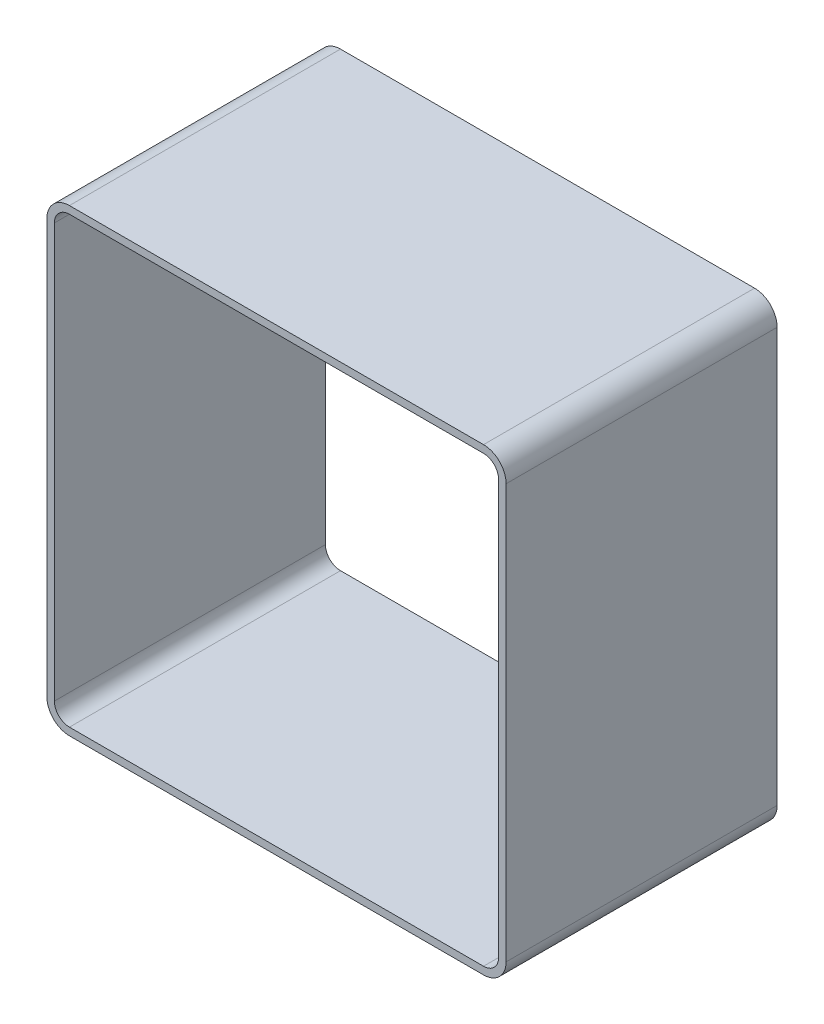
from build123d import *

# Parameters (mm, degrees)
ESQUISSE1_W              = 305
ESQUISSE1_H              = 305
BOSS_EXTRU_1_DEPTH       = 180
ESQUISSE2_R              = 10
ENL_V_MAT_EXTRU_10_DEPTH = 10
CONG_2_R                 = 15
ENL_V_MAT_EXTRU_11_DEPTH = 180


with BuildPart() as part:
    # Esquisse1 → Boss.-Extru.1 (new body)
    with BuildSketch(Plane.XY):
        Rectangle(ESQUISSE1_W, ESQUISSE1_H)
    extrude(amount=BOSS_EXTRU_1_DEPTH)

    # Esquisse2 → Enlèv. mat.-Extru.10 (cut)
    with BuildSketch(Plane.XY.offset(180)):
        with Locations((137.5, 137.5)):
            Circle(ESQUISSE2_R)
        with Locations((137.5, -137.5)):
            Circle(ESQUISSE2_R)
        with Locations((-137.5, -137.5)):
            Circle(ESQUISSE2_R)
        with Locations((-137.5, 137.5)):
            Circle(ESQUISSE2_R)
    extrude(amount=-ENL_V_MAT_EXTRU_10_DEPTH, mode=Mode.SUBTRACT)

    # Congé2
    cong_2_edges = [part.edges().sort_by_distance(p)[0] for p in [
        (-152.5, 152.5, 90),
        (152.5, 152.5, 90),
        (152.5, -152.5, 90),
        (-152.5, -152.5, 90),
    ]]
    fillet(cong_2_edges, radius=CONG_2_R)

    # Esquisse3 → Enlèv. mat.-Extru.11 (cut)
    with BuildSketch(Plane.XY.offset(180)):
        with BuildLine():
            Line((-137.5, 147.5), (137.5, 147.5))
            ThreePointArc((137.5, 147.5), (144.571068, 144.571068), (147.5, 137.5))
            Line((147.5, 137.5), (147.5, -137.5))
            ThreePointArc((147.5, -137.5), (144.571068, -144.571068), (137.5, -147.5))
            Line((137.5, -147.5), (-137.5, -147.5))
            ThreePointArc((-137.5, -147.5), (-144.571068, -144.571068), (-147.5, -137.5))
            Line((-147.5, -137.5), (-147.5, 137.5))
            ThreePointArc((-147.5, 137.5), (-144.571068, 144.571068), (-137.5, 147.5))
        make_face()
    extrude(amount=-ENL_V_MAT_EXTRU_11_DEPTH, mode=Mode.SUBTRACT)


solid = part.part
